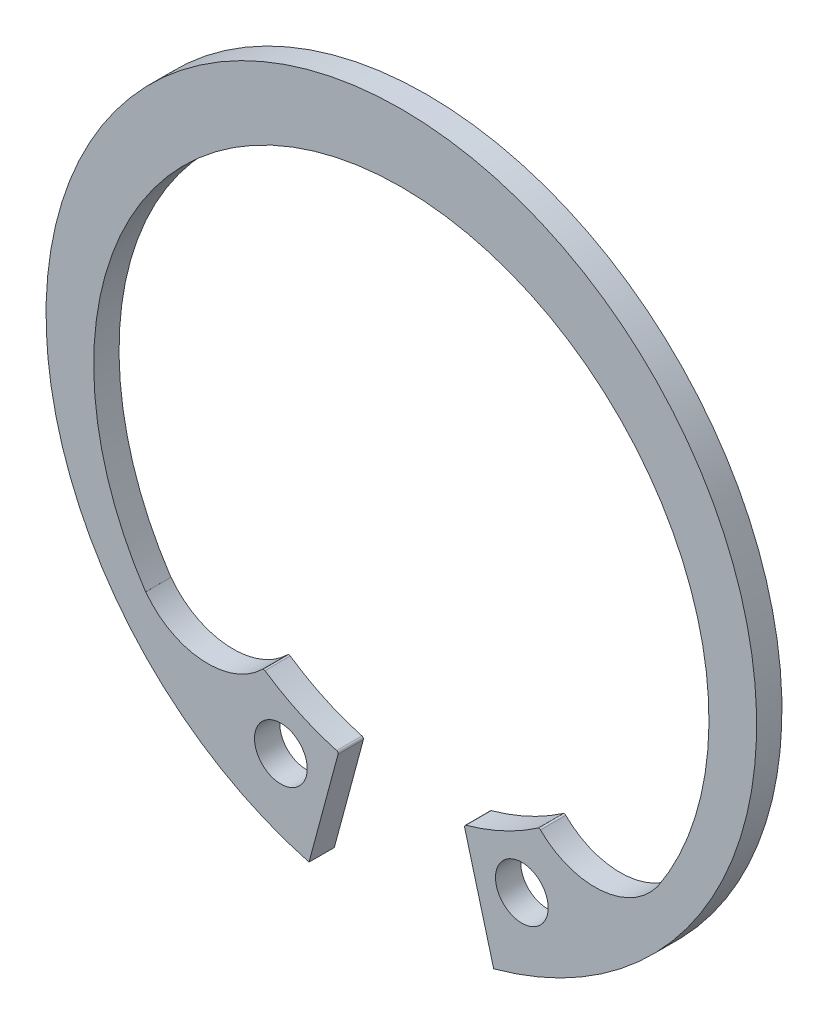
from build123d import *

# Parameters (mm, degrees)
BODYSKE_R    = 1.25
BODY_DEPTH   = 1.2
MODLUGSKE_R  = 1.25
MODLUG_DEPTH = 1.2


with BuildPart() as part:
    # BodySke → Body (new body)
    with BuildSketch(Plane.XY):
        with BuildLine():
            Line((4.378799842, -16.271097441), (3.517368932, -13.070123021))
            ThreePointArc((3.517368932, -13.070123021), (4.598593065, -10.496238254), (7.359812721, -10.908056702))
            ThreePointArc((7.359812721, -10.908056702), (9.01864957, -11.612154844), (10.669183486, -10.888807293))
            ThreePointArc((10.669183486, -10.888807293), (0, 13.65), (-10.669183486, -10.888807293))
            ThreePointArc((-10.669183486, -10.888807293), (-9.01864957, -11.612154844), (-7.359812721, -10.908056702))
            ThreePointArc((-7.359812721, -10.908056702), (-4.598593065, -10.496238254), (-3.517368932, -13.070123021))
            Line((-3.517368932, -13.070123021), (-4.378799842, -16.271097441))
            ThreePointArc((-4.378799842, -16.271097441), (0, 16.85), (4.378799842, -16.271097441))
        make_face()
        with Locations((5.714208497, -12.478920075)):
            Circle(BODYSKE_R, mode=Mode.SUBTRACT)
        with Locations((-5.714208497, -12.478920075)):
            Circle(BODYSKE_R, mode=Mode.SUBTRACT)
    extrude(amount=-BODY_DEPTH)

    # ModLugSke → ModLug (add, through all)
    # profile 1 of 2: a face of its own
    with BuildSketch(Plane.XY):
        with BuildLine():
            Line((4.378799842, -16.271097441), (3.00137938, -11.152767451))
            ThreePointArc((3.00137938, -11.152767451), (3.011071656, -11.077250335), (3.071121733, -11.030444746))
            ThreePointArc((3.071121733, -11.030444746), (4.835173781, -10.37899776), (6.468805393, -9.447595291))
            ThreePointArc((6.468805393, -9.447595291), (6.534244643, -9.430507742), (6.595593054, -9.458979698))
            ThreePointArc((6.595593054, -9.458979698), (9.454353639, -10.509410242), (12.123361918, -9.042334507))
            Line((12.123361918, -9.042334507), (13.506791172, -10.074179482))
            ThreePointArc((13.506791172, -10.074179482), (9.464356266, -13.940891667), (4.378799842, -16.271097441))
        make_face()
        with Locations((5.714208497, -12.478920075)):
            Circle(MODLUGSKE_R, mode=Mode.SUBTRACT)
    # profile 2 of 2: a face of its own
    with BuildSketch(Plane.XY):
        with BuildLine():
            Line((-4.378799842, -16.271097441), (-3.00137938, -11.152767451))
            ThreePointArc((-3.00137938, -11.152767451), (-3.011071656, -11.077250335), (-3.071121733, -11.030444746))
            ThreePointArc((-3.071121733, -11.030444746), (-4.835173781, -10.37899776), (-6.468805393, -9.447595291))
            ThreePointArc((-6.468805393, -9.447595291), (-6.534244643, -9.430507742), (-6.595593054, -9.458979698))
            ThreePointArc((-6.595593054, -9.458979698), (-9.454353639, -10.509410242), (-12.123361918, -9.042334507))
            Line((-12.123361918, -9.042334507), (-13.506791172, -10.074179482))
            ThreePointArc((-13.506791172, -10.074179482), (-9.464356266, -13.940891667), (-4.378799842, -16.271097441))
        make_face()
        with Locations((-5.714208497, -12.478920075)):
            Circle(MODLUGSKE_R, mode=Mode.SUBTRACT)
    extrude(amount=-MODLUG_DEPTH)


solid = part.part
